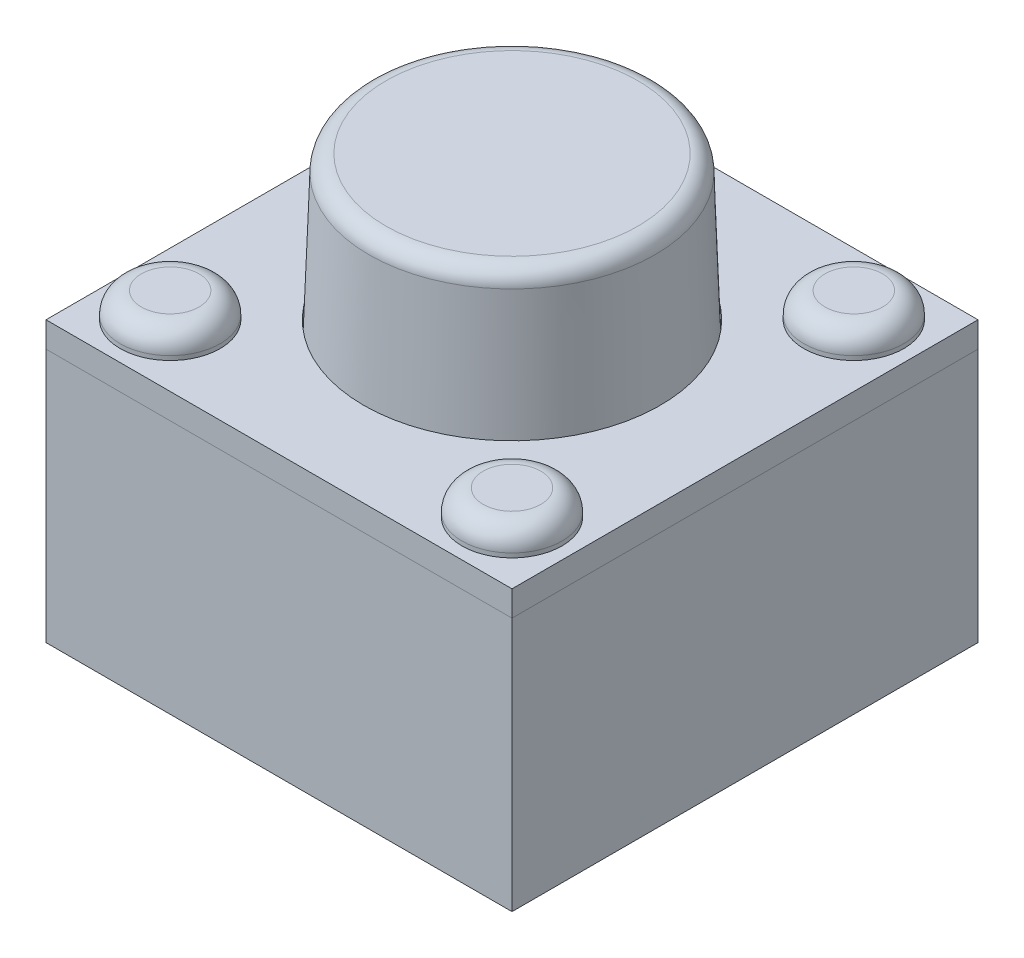
from build123d import *

# Parameters (mm, degrees)
SKETCH1_W           = 5.5
SKETCH1_H           = 5.5
BOSS_EXTRUDE1_DEPTH = 3
SKETCH2_W           = 5.5
SKETCH2_H           = 5.5
SKETCH2_R           = 1.75
SKETCH2_R_2         = 0.59
BOSS_EXTRUDE2_DEPTH = 0.3
SKETCH2_2_R         = 0.59
BOSS_EXTRUDE3_DEPTH = 0.6
SKETCH2_3_R         = 1.75
BOSS_EXTRUDE4_DEPTH = 2
BOSS_EXTRUDE4_TAPER = 2
FILLET1_R           = 0.25
FILLET2_R           = 0.2


with BuildPart() as part:
    # Sketch1 → Boss-Extrude1 (new body)
    with BuildSketch(Plane(origin=(0, 0, 0), x_dir=(1, 0, 0), z_dir=(0, 1, 0))):
        Rectangle(SKETCH1_W, SKETCH1_H)
    extrude(amount=BOSS_EXTRUDE1_DEPTH)

    # Sketch2<2> → Boss-Extrude3 (add)
    with BuildSketch(Plane(origin=(0, 3, 0), x_dir=(1, 0, 0), z_dir=(0, 1, 0))):
        with Locations((-2.017190272, 2.017190272)):
            Circle(SKETCH2_2_R)
        with Locations((2.017190272, 2.017190272)):
            Circle(SKETCH2_2_R)
        with Locations((2.017190272, -2.017190272)):
            Circle(SKETCH2_2_R)
        with Locations((-2.017190272, -2.017190272)):
            Circle(SKETCH2_2_R)
    extrude(amount=BOSS_EXTRUDE3_DEPTH)

    # Fillet1
    fillet1_edges = [part.edges().sort_by_distance(p)[0] for p in [
        (1.427190272, 3.6, -2.017190272),
        (1.427190272, 3.6, 2.017190272),
        (-2.607190272, 3.6, 2.017190272),
        (-2.607190272, 3.6, -2.017190272),
    ]]
    fillet(fillet1_edges, radius=FILLET1_R)


with BuildPart() as body_2:
    # Sketch2 → Boss-Extrude2 (new body)
    with BuildSketch(Plane(origin=(0, 3, 0), x_dir=(1, 0, 0), z_dir=(0, 1, 0))):
        Rectangle(SKETCH2_W, SKETCH2_H)
        Circle(SKETCH2_R, mode=Mode.SUBTRACT)
        with Locations((-2.017190272, 2.017190272)):
            Circle(SKETCH2_R_2, mode=Mode.SUBTRACT)
        with Locations((2.017190272, 2.017190272)):
            Circle(SKETCH2_R_2, mode=Mode.SUBTRACT)
        with Locations((2.017190272, -2.017190272)):
            Circle(SKETCH2_R_2, mode=Mode.SUBTRACT)
        with Locations((-2.017190272, -2.017190272)):
            Circle(SKETCH2_R_2, mode=Mode.SUBTRACT)
    extrude(amount=BOSS_EXTRUDE2_DEPTH)


with BuildPart() as body_3:
    # Sketch2<3> → Boss-Extrude4 (new body)
    with BuildSketch(Plane(origin=(0, 3, 0), x_dir=(1, 0, 0), z_dir=(0, 1, 0))):
        Circle(SKETCH2_3_R)
    extrude(amount=BOSS_EXTRUDE4_DEPTH, taper=BOSS_EXTRUDE4_TAPER)

    # Fillet2
    fillet2_edges = [body_3.edges().sort_by_distance(p)[0] for p in [
        (-1.680158461, 5, 0),
    ]]
    fillet(fillet2_edges, radius=FILLET2_R)


solid = Compound([part.part, body_2.part, body_3.part])
